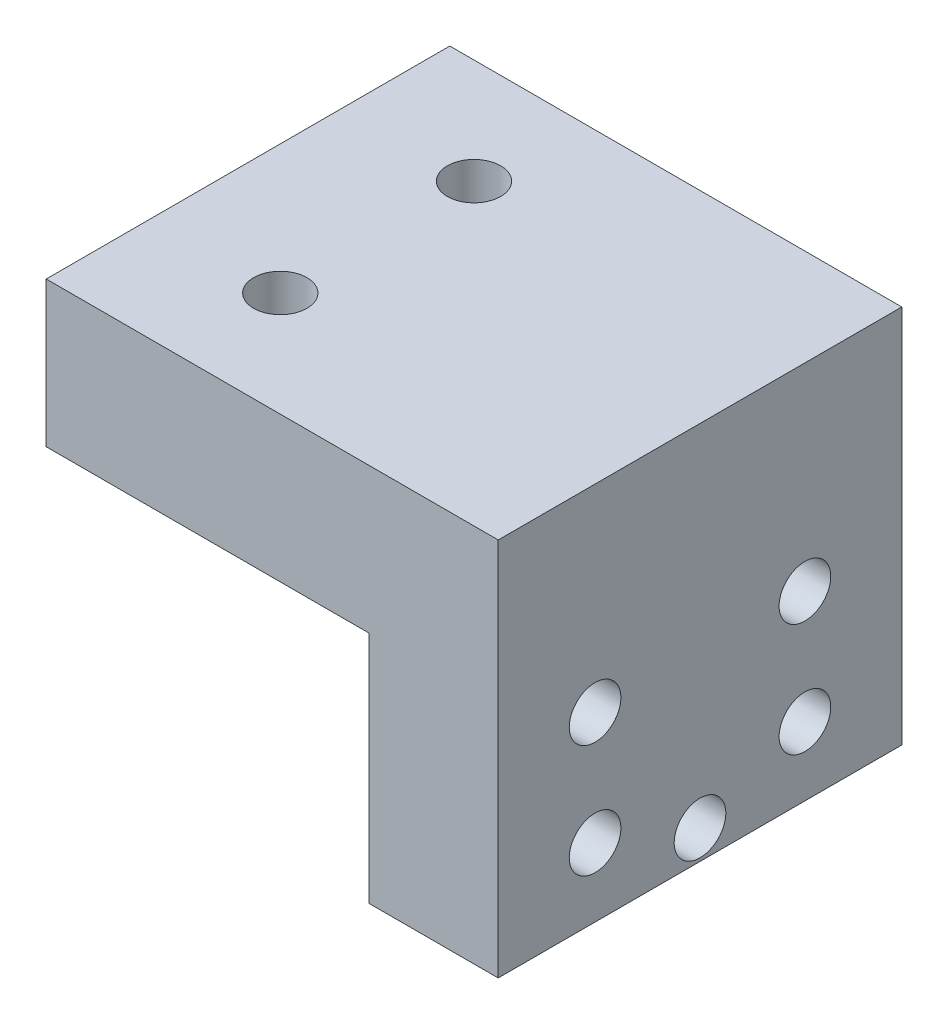
from build123d import *

# Parameters (mm, degrees)
EXTRUDE_1_DEPTH     = 25
SKETCH_2_R          = 1.65
CUT_EXTRUDE_1_DEPTH = 33
SKETCH_3_R          = 1.6
CUT_EXTRUDE_2_DEPTH = 33
CUT_EXTRUDE_3_DEPTH = 14.5


with BuildPart() as part:
    # 草图1 → 凸台-拉伸1 (new body)
    with BuildSketch(Plane.XY):
        Polygon((0, 0), (0, 23.5), (-28, 23.5), (-28, 14.5), (-8, 14.5), (-8, 0), align=None)
    extrude(amount=EXTRUDE_1_DEPTH)

    # 草图2 → 切除-拉伸1 (cut)
    with BuildSketch(Plane(origin=(0, 23.5, 0), x_dir=(1, 0, 0), z_dir=(0, 1, 0))):
        with Locations(Location((-20, -6.5, 0), (0, 0, 180))):
            Circle(SKETCH_2_R)
        with Locations(Location((-20, -18.5, 0), (0, 0, 180))):
            Circle(SKETCH_2_R)
    extrude(amount=-CUT_EXTRUDE_1_DEPTH, mode=Mode.SUBTRACT)

    # 草图3 → 切除-拉伸2 (cut)
    with BuildSketch(Plane.ZY.offset(8)):
        with Locations(Location((6, 11.25, 0), (0, 0, 270))):
            Circle(SKETCH_3_R)
        with Locations(Location((19, 11.25, 0), (0, 0, 270))):
            Circle(SKETCH_3_R)
        with Locations(Location((12.5, 1.8, 0), (0, 0, 270))):
            Circle(SKETCH_3_R)
        with Locations(Location((6, 4.25, 0), (0, 0, 270))):
            Circle(SKETCH_3_R)
        with Locations(Location((19, 4.25, 0), (0, 0, 270))):
            Circle(SKETCH_3_R)
    extrude(amount=-CUT_EXTRUDE_2_DEPTH, mode=Mode.SUBTRACT)

    # 草图4 → 切除-拉伸3 (cut)
    with BuildSketch(Plane.XZ):
        with BuildLine():
            Line((-8, 14.724859546), (-8, 10.275140454))
            ThreePointArc((-8, 10.275140454), (-2.5, 12.5), (-8, 14.724859546))
        make_face()
    extrude(amount=-CUT_EXTRUDE_3_DEPTH, mode=Mode.SUBTRACT)


solid = part.part
